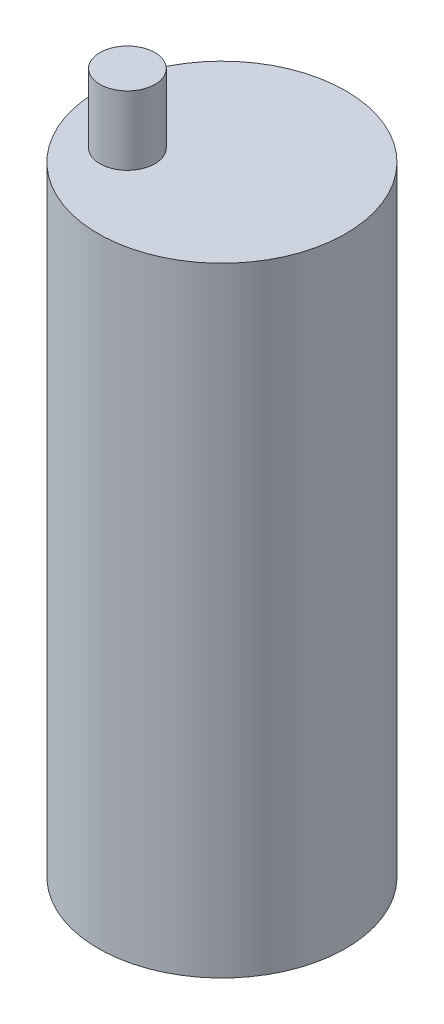
from build123d import *

# Parameters (mm, degrees)
SKETCH_1_R      = 9
EXTRUDE_1_DEPTH = 45
SKETCH_2_R      = 2
EXTRUDE_2_DEPTH = 5


with BuildPart() as part:
    # 草图1 → 凸台-拉伸1 (new body)
    with BuildSketch(Plane(origin=(0, 0, 0), x_dir=(1, 0, 0), z_dir=(0, 1, 0))):
        with Locations(Location((0, 0, 0), (0, 0, 90))):
            Circle(SKETCH_1_R)
    extrude(amount=EXTRUDE_1_DEPTH)

    # 草图2 → 凸台-拉伸2 (add)
    with BuildSketch(Plane(origin=(0, 45, 0), x_dir=(1, 0, 0), z_dir=(0, 1, 0))):
        with Locations(Location((-4.339580044, -2.533196547, 0), (0, 0, 270))):
            Circle(SKETCH_2_R)
    extrude(amount=EXTRUDE_2_DEPTH)


solid = part.part
